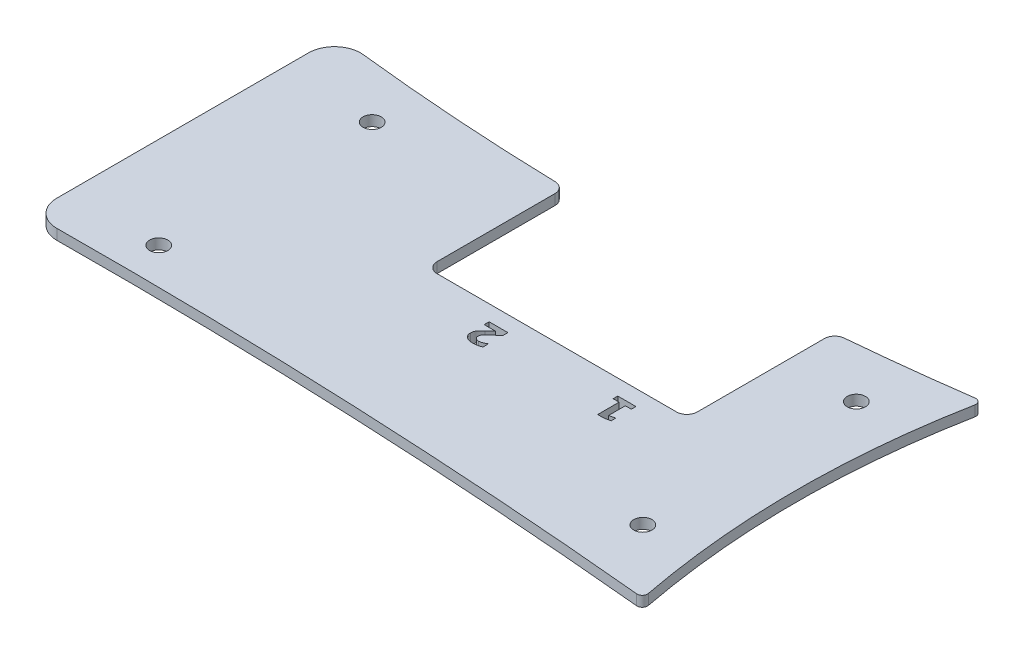
from build123d import *

# Parameters (mm, degrees)
CROQUIS1_R              = 2.175
SALIENTE_EXTRUIR1_DEPTH = 2
SALIENTE_EXTRUIR2_START = -2
CROQUIS2_R              = 2.175
CROQUIS2_R_2            = 1.75
SALIENTE_EXTRUIR2_DEPTH = 2
CROQUIS3_W              = 50
CROQUIS3_H              = 30
CORTAR_EXTRUIR1_DEPTH   = 2
REDONDEO1_R             = 2
CORTAR_EXTRUIR2_DEPTH   = 2


with BuildPart() as part:
    # Croquis1 → Saliente-Extruir1 (new body)
    with BuildSketch(Plane(origin=(0, 0, 0), x_dir=(1, 0, 0), z_dir=(0, 1, 0))):
        with BuildLine():
            Line((-5.038018703, 53.362868047), (-5.038018703, 4.999855456))
            ThreePointArc((-5.038018703, 4.999855456), (-3.560085318, 1.450905363), (0, 0))
            ThreePointArc((0, 0), (58.295330849, -1.055734), (116.459334215, -5.106522257))
            ThreePointArc((116.459334215, -5.106522257), (117.294081225, -4.78404952), (117.536525368, -3.922648293))
            ThreePointArc((117.536525368, -3.922648293), (114.552978917, 27.433067341), (117.524427855, 58.789931717))
            ThreePointArc((117.524427855, 58.789931717), (117.266809662, 59.667185903), (116.403513339, 59.968286381))
            ThreePointArc((116.403513339, 59.968286381), (58.510820536, 55.521592761), (0.515666266, 58.332116778))
            ThreePointArc((0.515666266, 58.332116778), (-3.372053433, 57.089020542), (-5.038018703, 53.362868047))
        make_face()
        with Locations(Location((105.593713907, 6.96520452, 0), (0, 0, 270))):
            Circle(CROQUIS1_R, mode=Mode.SUBTRACT)
        with Locations(Location((105.593713907, 47.96520452, 0), (0, 0, 270))):
            Circle(CROQUIS1_R, mode=Mode.SUBTRACT)
        with Locations(Location((12.593713907, 47.96520452, 0), (0, 0, 270))):
            Circle(CROQUIS1_R, mode=Mode.SUBTRACT)
        with Locations(Location((12.593713907, 6.96520452, 0), (0, 0, 270))):
            Circle(CROQUIS1_R, mode=Mode.SUBTRACT)
    extrude(amount=SALIENTE_EXTRUIR1_DEPTH)

    # Croquis2 → Saliente-Extruir2 (add)
    # profile 1 of 4: a face of its own
    with BuildSketch(Plane(origin=(0, 2, 0), x_dir=(1, 0, 0), z_dir=(0, 1, 0)).offset(SALIENTE_EXTRUIR2_START)):
        with Locations((12.593713907, 6.96520452)):
            Circle(CROQUIS2_R)
        with Locations(Location((12.593713907, 6.96520452, 0), (0, 0, 270))):
            Circle(CROQUIS2_R_2, mode=Mode.SUBTRACT)
    # profile 2 of 4: a face of its own
    with BuildSketch(Plane(origin=(0, 2, 0), x_dir=(1, 0, 0), z_dir=(0, 1, 0)).offset(SALIENTE_EXTRUIR2_START)):
        with Locations((105.593713907, 6.96520452)):
            Circle(CROQUIS2_R)
        with Locations(Location((105.593713907, 6.96520452, 0), (0, 0, 270))):
            Circle(CROQUIS2_R_2, mode=Mode.SUBTRACT)
    # profile 3 of 4: a face of its own
    with BuildSketch(Plane(origin=(0, 2, 0), x_dir=(1, 0, 0), z_dir=(0, 1, 0)).offset(SALIENTE_EXTRUIR2_START)):
        with Locations((105.593713907, 47.96520452)):
            Circle(CROQUIS2_R)
        with Locations(Location((105.593713907, 47.96520452, 0), (0, 0, 270))):
            Circle(CROQUIS2_R_2, mode=Mode.SUBTRACT)
    # profile 4 of 4: a face of its own
    with BuildSketch(Plane(origin=(0, 2, 0), x_dir=(1, 0, 0), z_dir=(0, 1, 0)).offset(SALIENTE_EXTRUIR2_START)):
        with Locations((12.593713907, 47.96520452)):
            Circle(CROQUIS2_R)
        with Locations(Location((12.593713907, 47.96520452, 0), (0, 0, 270))):
            Circle(CROQUIS2_R_2, mode=Mode.SUBTRACT)
    extrude(amount=SALIENTE_EXTRUIR2_DEPTH)

    # Croquis3 → Cortar-Extruir1 (cut)
    with BuildSketch(Plane.XZ):
        with Locations((67.042264057, -43.977959042)):
            Rectangle(CROQUIS3_W, CROQUIS3_H)
    extrude(amount=-CORTAR_EXTRUIR1_DEPTH, mode=Mode.SUBTRACT)

    # Redondeo1
    redondeo1_edges = [part.edges().sort_by_distance(p)[0] for p in [
        (92.042264057, 1, -57.208472181),
        (42.042264057, 1, -55.581052497),
        (92.042264057, 1, -28.977959042),
        (42.042264057, 1, -28.977959042),
    ]]
    fillet(redondeo1_edges, radius=REDONDEO1_R)

    # Croquis5 → Cortar-Extruir2 (cut)
    with BuildSketch(Plane.XZ):
        Polygon((85.245219848, -25.091883093), (84.105979342, -25.091883093), (84.105979342, -21.864034991), (85.245219848, -22.117199548), (85.245219848, -21.231123599), (84.105979342, -20.977959042), (82.903447696, -20.977959042), (82.903447696, -25.091883093), (81.76420719, -25.091883093), (81.76420719, -25.977959042), (85.245219848, -25.977959042), align=None)
        with BuildLine():
            Line((59.23923156, -25.028591953), (57.043820167, -25.028591953))
            Line((57.043820167, -25.028591953), (57.043820167, -25.977959042))
            Line((57.043820167, -25.977959042), (60.651415104, -25.977959042))
            Line((60.651415104, -25.977959042), (60.651415104, -25.028591953))
            Line((60.651415104, -25.028591953), (58.849595484, -23.39686727))
            add(Edge.make_bspline(
                [(58.849595484, -23.39686727), (58.811179508, -23.360453729), (58.737347895, -23.290470593), (58.638846251, -23.181308349), (58.556039894, -23.073418427), (58.488647556, -22.9656663), (58.436579253, -22.857270202), (58.399356742, -22.7471273), (58.376788079, -22.635006299), (58.374215363, -22.559348688), (58.372934091, -22.521669485)],
                knots=[0, 0, 0, 0, 1.236280052, 2.376004991, 3.431121006, 4.409922617, 5.340004737, 6.23379528, 7.120390076, 8, 8, 8, 8], degree=3))
            add(Edge.make_bspline(
                [(58.372934091, -22.521669485), (58.373734222, -22.492954485), (58.375303557, -22.436634341), (58.386395262, -22.354534572), (58.403952327, -22.27651726), (58.429843029, -22.202852998), (58.463496065, -22.13358734), (58.504554072, -22.068788136), (58.55230711, -22.007870779), (58.607454048, -21.95191928), (58.668588665, -21.901761082), (58.734750953, -21.857510772), (58.805768742, -21.820347701), (58.881617778, -21.78880132), (58.962945343, -21.766978108), (59.048496141, -21.750115414), (59.138706913, -21.738517651), (59.200626269, -21.737813177), (59.232309091, -21.737452713)],
                knots=[0, 0, 0, 0, 1.051570438, 2.062496947, 3.029041388, 3.976082297, 4.915705016, 5.843618098, 6.780832819, 7.745641109, 8.714971964, 9.672728077, 10.655724248, 11.646770331, 12.675069334, 13.733548982, 14.840305057, 16, 16, 16, 16], degree=3))
            add(Edge.make_bspline(
                [(59.232309091, -21.737452713), (59.283483298, -21.739078861), (59.388654688, -21.742420863), (59.549919694, -21.767428422), (59.717848281, -21.808754845), (59.893140764, -21.864093074), (60.074545452, -21.936143809), (60.262356788, -22.023375721), (60.45625408, -22.126411077), (60.585178282, -22.203946693), (60.651415104, -22.243781827)],
                knots=[0, 0, 0, 0, 0.805289075, 1.655001185, 2.562337436, 3.525570902, 4.545914286, 5.63233367, 6.783574439, 8, 8, 8, 8], degree=3))
            Line((60.651415104, -22.243781827), (60.651415104, -21.16783246))
            add(Edge.make_bspline(
                [(60.651415104, -21.16783246), (60.580024738, -21.143346845), (60.438298447, -21.094737271), (60.22526093, -21.029932245), (60.012697372, -20.977227076), (59.802522423, -20.931042179), (59.593297587, -20.895451623), (59.386119489, -20.869557673), (59.180786794, -20.854336471), (59.044767338, -20.852359369), (58.977166686, -20.851376764)],
                knots=[0, 0, 0, 0, 1.057875713, 2.100126525, 3.11992041, 4.126788656, 5.115814745, 6.093540533, 7.052503917, 8, 8, 8, 8], degree=3))
            add(Edge.make_bspline(
                [(58.977166686, -20.851376764), (58.905262711, -20.85238657), (58.765150213, -20.854354283), (58.561236326, -20.873331522), (58.369861257, -20.904710686), (58.190983935, -20.948290574), (58.02362641, -21.003040105), (57.869196403, -21.072605629), (57.726828905, -21.153727261), (57.597883717, -21.246919107), (57.482225307, -21.350888685), (57.382280492, -21.4662574), (57.296169552, -21.590505745), (57.226253234, -21.725372616), (57.173379692, -21.870513757), (57.134463349, -22.024856787), (57.111652808, -22.189040836), (57.108650287, -22.301727129), (57.107111307, -22.359485941)],
                knots=[0, 0, 0, 0, 1.268578714, 2.471959742, 3.60996102, 4.687843336, 5.71795552, 6.712571594, 7.671453871, 8.604637305, 9.514783325, 10.409481047, 11.292070208, 12.17665072, 13.082156293, 14.011888661, 14.980967898, 16, 16, 16, 16], degree=3))
            add(Edge.make_bspline(
                [(57.107111307, -22.359485941), (57.109580941, -22.426905794), (57.114488685, -22.560884856), (57.153988801, -22.758138197), (57.220643738, -22.947717445), (57.29612885, -23.101195245), (57.373494642, -23.224613477), (57.44767263, -23.324133234), (57.534574057, -23.431842783), (57.636091495, -23.546775274), (57.751967056, -23.669028973), (57.881725831, -23.799417167), (58.024876774, -23.938220802), (58.127076255, -24.031061987), (58.180093902, -24.079224865)],
                knots=[0, 0, 0, 0, 1.157790159, 2.300800598, 3.440029832, 4.602686419, 5.231283155, 5.940454419, 6.733913406, 7.608806261, 8.574423064, 9.627750849, 10.769357098, 12, 12, 12, 12], degree=3))
            Line((58.180093902, -24.079224865), (59.23923156, -25.028591953))
        make_face()
    extrude(amount=-CORTAR_EXTRUIR2_DEPTH, mode=Mode.SUBTRACT)


solid = part.part
